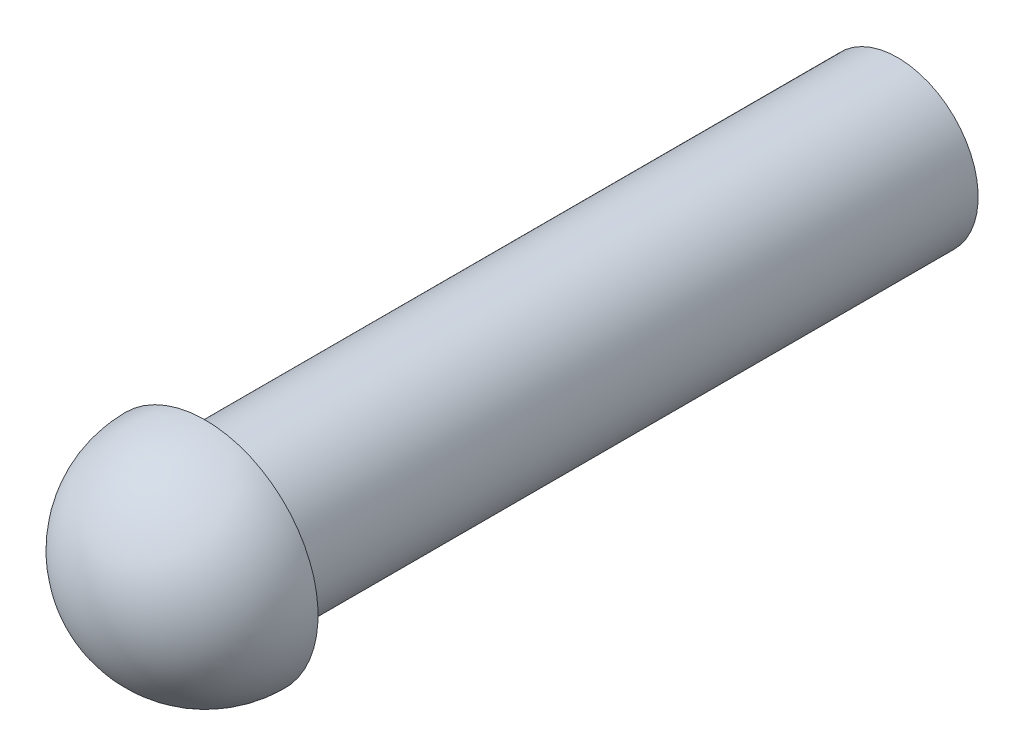
from build123d import *
from build123d.topology import SkipClean

# Parameters (mm, degrees)
REVOLVE_4_ANGLE     = 180.0000000000004
SKETCH_2_W          = 15.068111951450035
SKETCH_2_H          = 7.96575550760617
CUT_EXTRUDE_1_DEPTH = 56.00000000000002
SKETCH_3_R          = 4.999999999999991
EXTRUDE_2_DEPTH     = 43.00000000000001
SKETCH_45_R         = 8.000000000000014
CUT_EXTRUDE_2_DEPTH = 10
REVOLVE_5_ANGLE     = 180.0000000000004


with BuildPart() as part:
    # 草图1 → 旋转4 (revolve)
    with BuildSketch(Plane.XY):
        with BuildLine():
            Line((110.00000000000001, 81.99999999999996), (110.00000000000001, 89.99999999999999))
            Line((110.00000000000001, 89.99999999999999), (110.00000000000001, 98))
            ThreePointArc((110.00000000000001, 98), (102, 89.99999999999999), (110.00000000000001, 81.99999999999997))
        make_face()
    revolve(axis=Axis((110.00000000000001, 81.99999999999996, 0), (0, 1, 0)), revolution_arc=REVOLVE_4_ANGLE)

    # 草图2 → 切除-拉伸1 (cut)
    with SkipClean():  # the faces are left unmerged after this step: merging them gives an invalid solid
        with BuildSketch(Plane(origin=(0, 119.99999999999999, 0), x_dir=(1, 0, 0), z_dir=(0, 1, 0))):
            with Locations((110, -6.673230993554715)):
                Rectangle(SKETCH_2_W, SKETCH_2_H)
        extrude(amount=-CUT_EXTRUDE_1_DEPTH, mode=Mode.SUBTRACT)

    # 草图45 → 切除-拉伸2 (cut)
    with BuildSketch(Plane(origin=(0, 0, 0), x_dir=(-1, 0, 6.98e-15), z_dir=(-6.98e-15, 0, -1))):
        with Locations((-110.00000000000001, 89.99999999999999)):
            Circle(SKETCH_45_R)
    extrude(amount=-CUT_EXTRUDE_2_DEPTH, mode=Mode.SUBTRACT)


with BuildPart() as body_2:
    # 草图3 → 凸台-拉伸2 (new body)
    with BuildSketch(Plane(origin=(0, 0, 0), x_dir=(-1, 0, 6.98e-15), z_dir=(-6.98e-15, 0, -1))):
        with Locations((-117.96224151764466, 79.27742160371339)):
            Circle(SKETCH_3_R)
    extrude(amount=EXTRUDE_2_DEPTH)

    # 草图46 → 旋转5 (revolve)
    with BuildSketch(Plane.XY):
        with BuildLine():
            ThreePointArc((117.96224151764446, 74.2774216037134), (112.96224151764467, 79.2774216037134), (117.96224151764447, 84.27742160371338))
            Line((117.96224151764436, 84.27742160371338), (117.96224151764436, 86.27742160371339))
            ThreePointArc((117.96224151764436, 86.27742160371339), (110.96224151764436, 79.27742160371339), (117.96224151764436, 72.27742160371339))
            Line((117.96224151764436, 72.27742160371338), (117.96224151764436, 74.2774216037134))
        make_face()
        with BuildLine():
            Line((117.96224151764436, 74.2774216037134), (117.96224151764436, 79.27742160371339))
            Line((117.96224151764436, 79.27742160371339), (117.96224151764436, 84.27742160371338))
            ThreePointArc((117.96224151764447, 84.27742160371338), (112.96224151764467, 79.2774216037134), (117.96224151764446, 74.2774216037134))
        make_face()
        with BuildLine():
            Line((117.96224151764436, 84.27742160371338), (117.96224151764436, 79.27742160371339))
            Line((117.96224151764436, 79.27742160371339), (117.96224151764436, 74.2774216037134))
            ThreePointArc((117.96224151764446, 74.2774216037134), (121.49777542357731, 75.74188769778058), (122.96224151764464, 79.27742160371339))
            ThreePointArc((122.96224151764464, 79.27742160371339), (121.49777542357732, 82.81295550964619), (117.96224151764447, 84.27742160371338))
        make_face()
    revolve(axis=Axis((117.96224151764436, 86.27742160371339, 0), (0, 1, 0)), revolution_arc=REVOLVE_5_ANGLE)


solid = body_2.part
